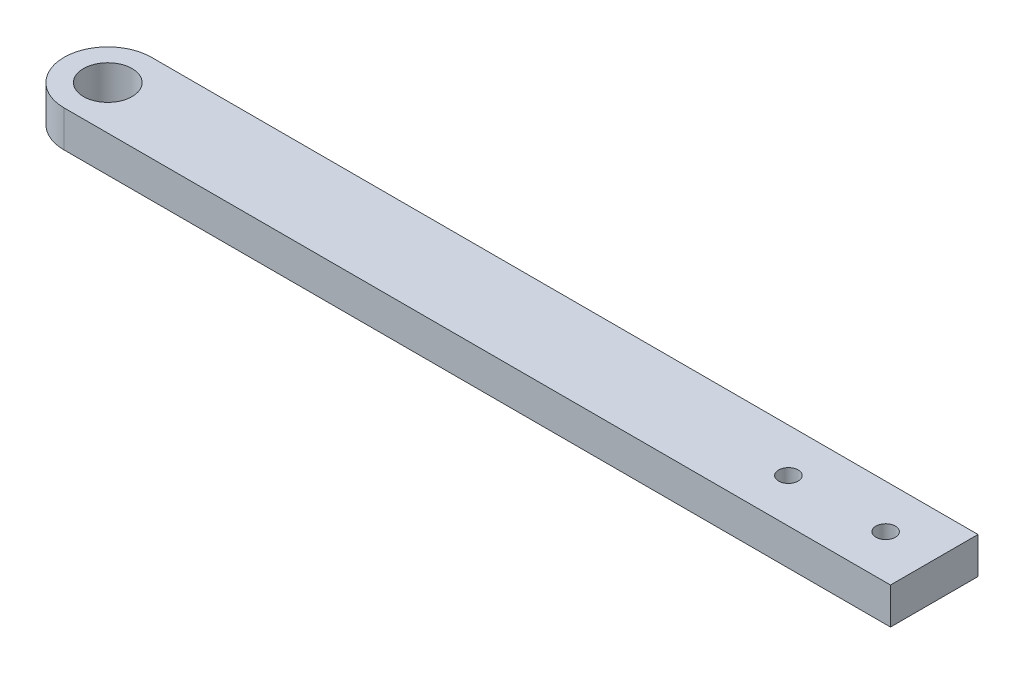
from build123d import *

# Parameters (mm, degrees)
BOSS_EXTRUDE1_DEPTH = 7.5
SKETCH2_R           = 5
SKETCH2_R_2         = 2
CUT_EXTRUDE1_DEPTH  = 171.403198327


with BuildPart() as part:
    # Sketch1 → Boss-Extrude1 (new body)
    with BuildSketch(Plane(origin=(0, 0, 0), x_dir=(1, 0, 0), z_dir=(0, 1, 0))):
        with BuildLine():
            Line((0, 9), (170, 9))
            Line((170, 9), (170, -9))
            Line((170, -9), (0, -9))
            ThreePointArc((0, -9), (-9, 0), (0, 9))
        make_face()
    extrude(amount=BOSS_EXTRUDE1_DEPTH)

    # Sketch2 → Cut-Extrude1 (cut, through all)
    with BuildSketch(Plane(origin=(0, 7.5, 0), x_dir=(1, 0, 0), z_dir=(0, 1, 0))):
        with Locations(Location((0, 0, 0), (0, 0, 270))):
            Circle(SKETCH2_R)
        with Locations(Location((160, 0, 0), (0, 0, 270))):
            Circle(SKETCH2_R_2)
        with Locations(Location((140, 0, 0), (0, 0, 270))):
            Circle(SKETCH2_R_2)
    extrude(amount=-CUT_EXTRUDE1_DEPTH, mode=Mode.SUBTRACT)


solid = part.part
